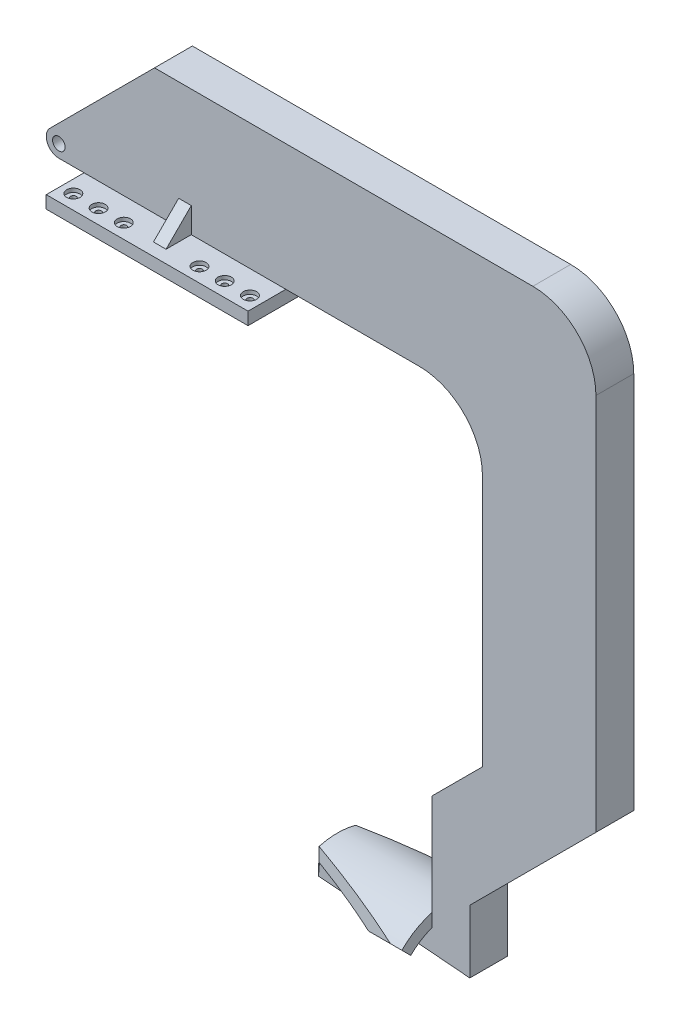
from build123d import *

# Parameters (mm, degrees)
SKETCH1_R                                        = 5
BOSS_EXTRUDE1_DEPTH                              = 30
SKETCH2_W                                        = 160
SKETCH2_H                                        = 30
BOSS_EXTRUDE2_DEPTH                              = 10
RIB1_REACH                                       = 529.146
SKETCH5_WALL_W                                   = 1084.577110596
SKETCH5_WALL_H                                   = 10
RIB17_REACH                                      = 529.146
SKETCH7_WALL_W                                   = 1084.577110596
SKETCH7_WALL_H                                   = 10
CBORE_FOR_M4_HEX_HEAD_MACHINE_SCREW2_D           = 4.5
CBORE_FOR_M4_HEX_HEAD_MACHINE_SCREW2_CBORE_D     = 10.59
CBORE_FOR_M4_HEX_HEAD_MACHINE_SCREW2_CBORE_DEPTH = 3
MIRROR2_COPY_1_D                                 = 4.5
MIRROR2_COPY_1_CBORE_D                           = 10.59
MIRROR2_COPY_1_CBORE_DEPTH                       = 3
BOSS_EXTRUDE5_DEPTH                              = 90
CUT_EXTRUDE4_DEPTH                               = 100
CUT_EXTRUDE4_DEPTH_BACK                          = 100


with BuildPart() as part:
    # Sketch1 → Boss-Extrude1 (new body)
    with BuildSketch(Plane.XY):
        with BuildLine():
            Line((-7.071067812, 7.071067812), (75.857864376, 90))
            Line((75.857864376, 90), (375.857864376, 90))
            ThreePointArc((375.857864376, 90), (411.213203436, 75.355339059), (425.857864376, 40))
            Line((425.857864376, 40), (425.857864376, -260))
            Line((425.857864376, -260), (325.857864376, -360))
            Line((325.857864376, -360), (325.857864376, -410))
            Line((325.857864376, -410), (205.857864376, -400))
            Line((205.857864376, -400), (205.857864376, -380))
            Line((205.857864376, -380), (295.857864376, -380))
            Line((295.857864376, -380), (295.857864376, -300))
            Line((295.857864376, -300), (335.857864376, -260))
            Line((335.857864376, -260), (335.857864376, -60))
            ThreePointArc((335.857864376, -60), (321.213203436, -24.644660941), (285.857864376, -10))
            Line((285.857864376, -10), (0, -10))
            ThreePointArc((0, -10), (-9.238795325, -3.826834324), (-7.071067812, 7.071067812))
        make_face()
        Circle(SKETCH1_R, mode=Mode.SUBTRACT)
    extrude(amount=BOSS_EXTRUDE1_DEPTH)

    # Sketch2 → Boss-Extrude2 (add)
    with BuildSketch(Plane.XZ.offset(10)):
        with Locations((100, 45)):
            Rectangle(SKETCH2_W, SKETCH2_H)
        with Locations((100, 15)):
            Rectangle(SKETCH2_W, SKETCH2_H)
        with Locations((100, -15)):
            Rectangle(SKETCH2_W, SKETCH2_H)
    extrude(amount=BOSS_EXTRUDE2_DEPTH)

    # Sketch5 wall → Rib1 (add, up to next)
    with BuildSketch(Plane(origin=(100, 0, 40), x_dir=(0, -0.707106781187, 0.707106781187), z_dir=(0, 0.707106781187, 0.707106781187)), mode=Mode.PRIVATE) as rib1_sk1:
        Rectangle(SKETCH5_WALL_W, SKETCH5_WALL_H)
    rib1_tool1 = extrude(rib1_sk1.sketch, amount=-RIB1_REACH, mode=Mode.PRIVATE) - part.part
    add(rib1_tool1.solids().sort_by_distance((100, 0, 40))[0])

    # Sketch7 wall → Rib17 (add, up to next)
    with BuildSketch(Plane(origin=(100, 0, -10), x_dir=(0, -0.707106781187, -0.707106781187), z_dir=(0, -0.707106781187, 0.707106781187)), mode=Mode.PRIVATE) as rib17_sk1:
        Rectangle(SKETCH7_WALL_W, SKETCH7_WALL_H)
    rib17_tool1 = extrude(rib17_sk1.sketch, amount=RIB17_REACH, mode=Mode.PRIVATE) - part.part
    add(rib17_tool1.solids().sort_by_distance((100, 0, -10))[0])

    # CBORE for M4 Hex Head Machine Screw2 (through all)
    with Locations(Plane(origin=(0, -10, 0), x_dir=(1, 0, 0), z_dir=(0, 1, 0))):
        with Locations((130, -48.5), (150, -48.5), (170, -48.5)):
            cbore_for_m4_hex_head_machine_screw2 = CounterBoreHole(CBORE_FOR_M4_HEX_HEAD_MACHINE_SCREW2_D / 2, CBORE_FOR_M4_HEX_HEAD_MACHINE_SCREW2_CBORE_D / 2, CBORE_FOR_M4_HEX_HEAD_MACHINE_SCREW2_CBORE_DEPTH)

    # Mirror1: CBORE for M4 Hex Head Machine Screw2 across plane
    add(cbore_for_m4_hex_head_machine_screw2.mirror(Plane(origin=(100, 0, 0), x_dir=(0, 0, 1), z_dir=(1, 0, 0))), mode=Mode.SUBTRACT)

    # Mirror2: CBORE for M4 Hex Head Machine Screw2 across plane
    add(cbore_for_m4_hex_head_machine_screw2.mirror(Plane.XY.offset(16)), mode=Mode.SUBTRACT)

    # Mirror2 copy 1 (through all)
    with Locations(Plane(origin=(200, -10, 32), x_dir=(-1, 0, 0), z_dir=(0, 1, 0))):
        with Locations((130, -48.5), (150, -48.5), (170, -48.5)):
            CounterBoreHole(MIRROR2_COPY_1_D / 2, MIRROR2_COPY_1_CBORE_D / 2, MIRROR2_COPY_1_CBORE_DEPTH)

    # Sketch19 → Boss-Extrude5 (add)
    with BuildSketch(Plane.ZY.offset(-295.857864376)):
        with BuildLine():
            Line((-23.890872965, -394.024153256), (-16.819805153, -401.095221068))
            ThreePointArc((-16.819805153, -401.095221068), (15, -387.915026221), (46.819805153, -401.095221068))
            Line((46.819805153, -401.095221068), (53.890872965, -394.024153256))
            ThreePointArc((53.890872965, -394.024153256), (15, -377.915026221), (-23.890872965, -394.024153256))
        make_face()
    extrude(amount=BOSS_EXTRUDE5_DEPTH)

    # Sketch20 → Cut-Extrude4 (cut, two sides: drawn at the far end of the back side and taken through both)
    with BuildSketch(Plane(origin=(-31.683738866, -380.204866396, 0), x_dir=(0.9965457582448797, -0.08304547985374006, 0), z_dir=(-0.08304547985374006, -0.9965457582448797, 0)).offset(-CUT_EXTRUDE4_DEPTH_BACK)):
        Polygon((228.178842993, -32.182148517), (344.185851358, -32.182148517), (238.364973487, 0), (228.178842993, 3.097796682), align=None)
        Polygon((238.364973487, 30), (346.499317462, 62.242718318), (228.178842993, 62.242718318), (228.178842993, 26.962773119), align=None)
    extrude(amount=CUT_EXTRUDE4_DEPTH + CUT_EXTRUDE4_DEPTH_BACK, mode=Mode.SUBTRACT)


solid = part.part
